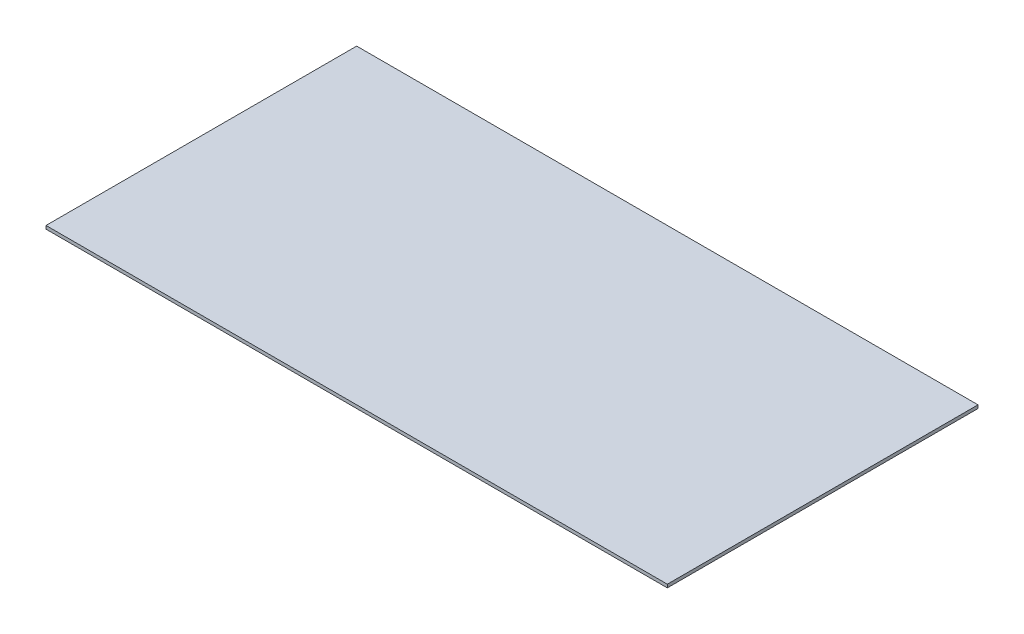
from build123d import *

# Parameters (mm, degrees)
SKETCH3_W           = 609.6
SKETCH3_H           = 3.175
BOSS_EXTRUDE1_DEPTH = 304.8


with BuildPart() as part:
    # Sketch3 → Boss-Extrude1 (new body)
    with BuildSketch(Plane.XY):
        with Locations((304.8, 1.5875)):
            Rectangle(SKETCH3_W, SKETCH3_H)
    extrude(amount=-BOSS_EXTRUDE1_DEPTH)


solid = part.part
